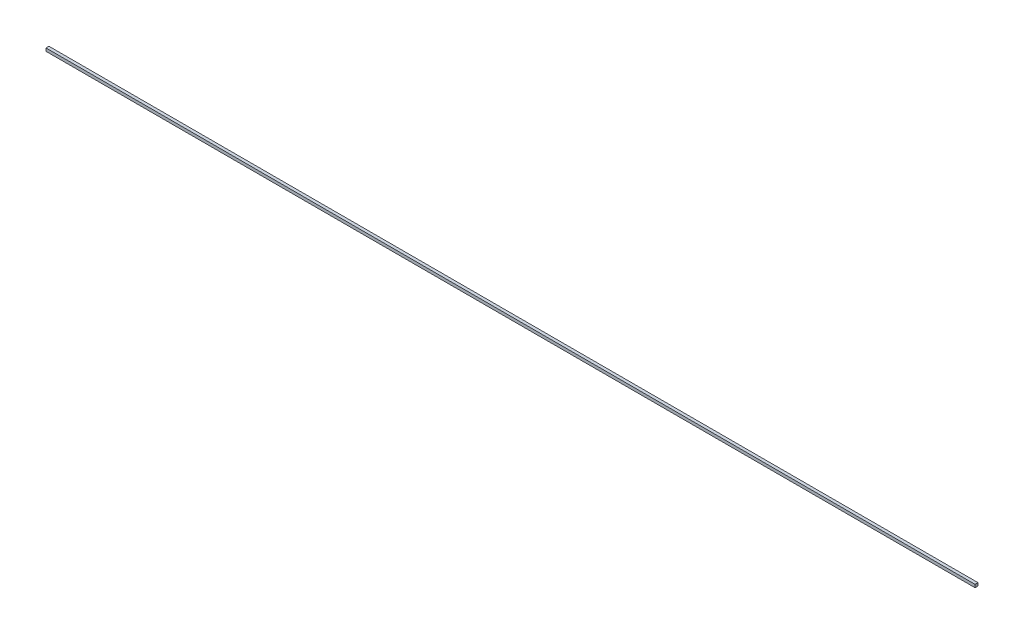
from build123d import *

# Parameters (mm, degrees)
SKETCH1_W           = 3.175
SKETCH1_H           = 3.175
BOSS_EXTRUDE1_DEPTH = 500


with BuildPart() as part:
    # Sketch1 → Boss-Extrude1 (new, symmetric)
    with BuildSketch(Plane(origin=(0, 0, 0), x_dir=(0, 0, -1), z_dir=(1, 0, 0))):
        Rectangle(SKETCH1_W, SKETCH1_H)
    extrude(amount=BOSS_EXTRUDE1_DEPTH, both=True)


solid = part.part
